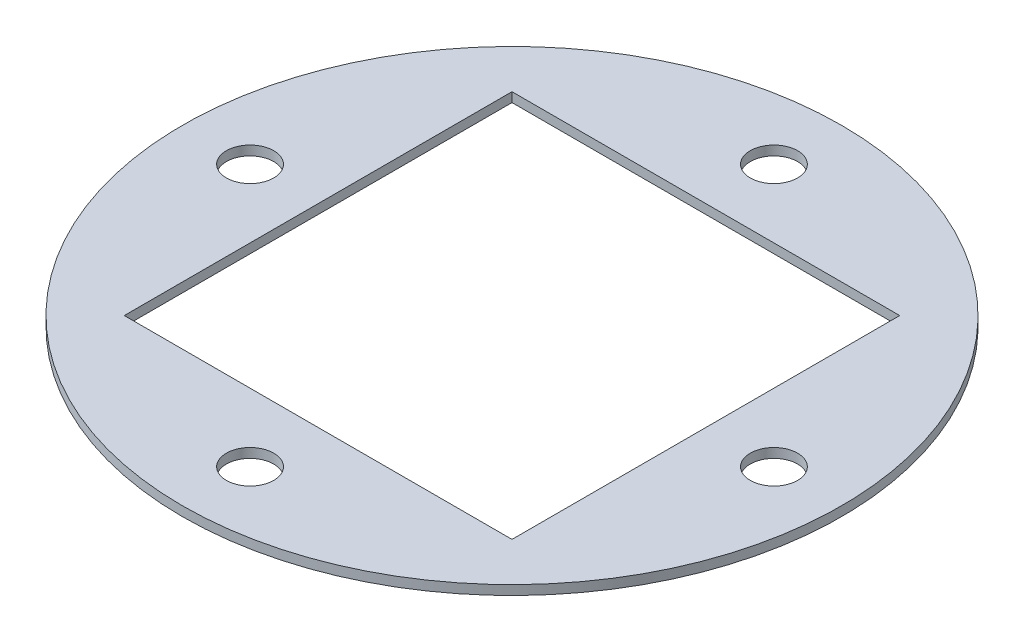
from build123d import *

# Parameters (mm, degrees)
SKETCH1_R           = 88.519
SKETCH1_W           = 104.14
SKETCH1_H           = 104.14
BOSS_EXTRUDE1_DEPTH = 2.54
SKETCH2_R           = 6.35
CUT_EXTRUDE1_DEPTH  = 126.210535986


with BuildPart() as part:
    # Sketch1 → Boss-Extrude1 (new body)
    with BuildSketch(Plane(origin=(0, 0, 0), x_dir=(1, 0, 0), z_dir=(0, 1, 0))):
        with Locations(Location((0, 0, 0), (0, 0, 270))):
            Circle(SKETCH1_R)
        Rectangle(SKETCH1_W, SKETCH1_H, mode=Mode.SUBTRACT)
    extrude(amount=BOSS_EXTRUDE1_DEPTH)

    # Sketch2 → Cut-Extrude1 (cut, through all)
    with BuildSketch(Plane(origin=(0, 2.54, 0), x_dir=(1, 0, 0), z_dir=(0, 1, 0))):
        with Locations(Location((0, 70.358, 0), (0, 0, 270))):
            Circle(SKETCH2_R)
        with Locations(Location((70.358, 0, 0), (0, 0, 270))):
            Circle(SKETCH2_R)
        with Locations(Location((0, -70.358, 0), (0, 0, 270))):
            Circle(SKETCH2_R)
        with Locations(Location((-70.358, 0, 0), (0, 0, 270))):
            Circle(SKETCH2_R)
    extrude(amount=-CUT_EXTRUDE1_DEPTH, mode=Mode.SUBTRACT)


solid = part.part
